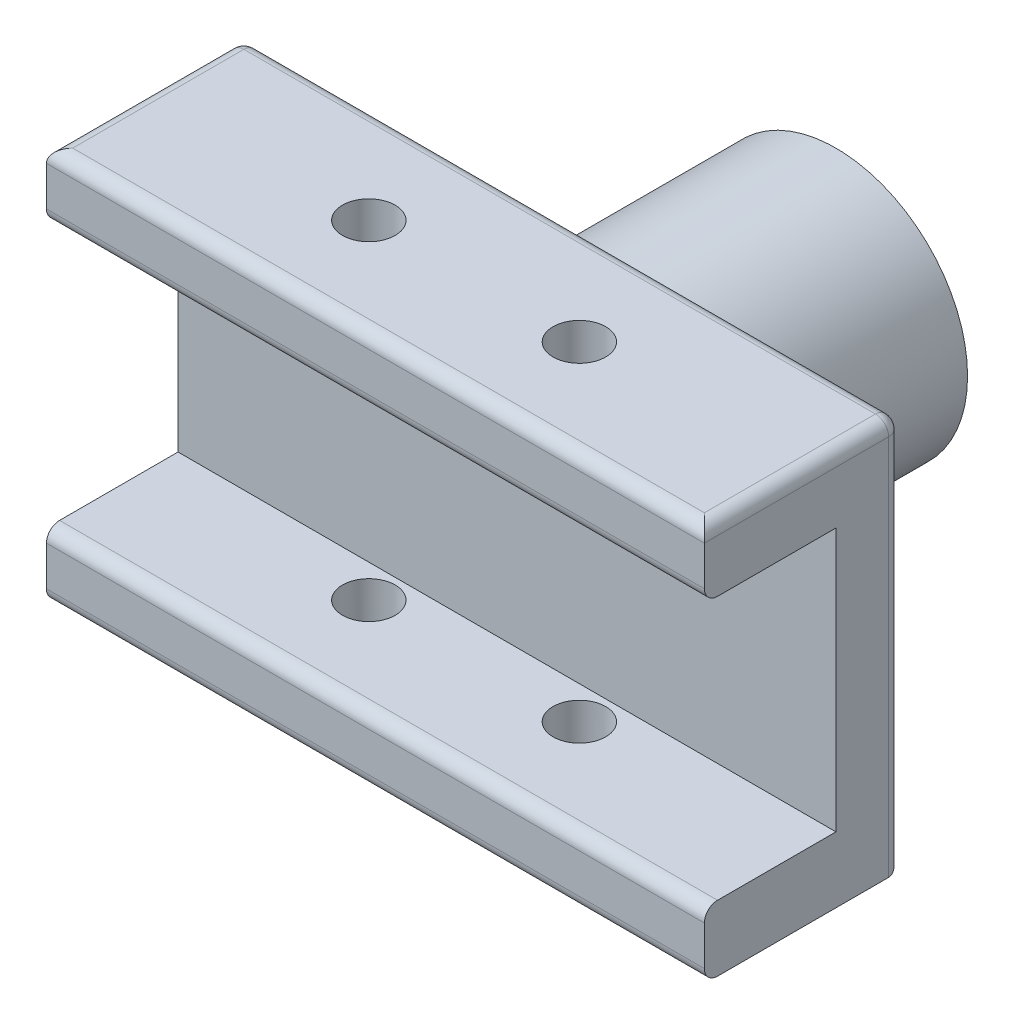
from build123d import *

# Parameters (mm, degrees)
SKETCH1_W           = 50
SKETCH1_H           = 30
BOSS_EXTRUDE1_DEPTH = 15
SKETCH2_W           = 50
SKETCH2_H           = 20
CUT_EXTRUDE1_DEPTH  = 10
SKETCH3_R           = 2
CUT_EXTRUDE2_DEPTH  = 42.833001327
SKETCH4_R           = 10
BOSS_EXTRUDE2_DEPTH = 20
FILLET3_R           = 1
FILLET4_R           = 1
FILLET5_R           = 1
FILLET6_R           = 1
FILLET7_R           = 1


with BuildPart() as part:
    # Sketch1 → Boss-Extrude1 (new body)
    with BuildSketch(Plane.XY):
        Rectangle(SKETCH1_W, SKETCH1_H)
    extrude(amount=BOSS_EXTRUDE1_DEPTH)

    # Sketch2 → Cut-Extrude1 (cut)
    with BuildSketch(Plane.XY.offset(15)):
        Rectangle(SKETCH2_W, SKETCH2_H)
    extrude(amount=-CUT_EXTRUDE1_DEPTH, mode=Mode.SUBTRACT)

    # Sketch3 → Cut-Extrude2 (cut, through all)
    with BuildSketch(Plane(origin=(0, 15, 0), x_dir=(1, 0, 0), z_dir=(0, 1, 0))):
        with Locations(Location((-8, -7.5, 0), (0, 0, 270))):
            Circle(SKETCH3_R)
        with Locations(Location((8, -7.5, 0), (0, 0, 270))):
            Circle(SKETCH3_R)
    extrude(amount=-CUT_EXTRUDE2_DEPTH, mode=Mode.SUBTRACT)

    # Sketch4 → Boss-Extrude2 (add)
    with BuildSketch(Plane(origin=(0, 0, 0), x_dir=(-1, 0, 0), z_dir=(0, 0, -1))):
        Circle(SKETCH4_R)
    extrude(amount=BOSS_EXTRUDE2_DEPTH)

    # Fillet3
    fillet3_edges = [part.edges().sort_by_distance(p)[0] for p in [
        (0, -10, 15),
    ]]
    fillet(fillet3_edges, radius=FILLET3_R)

    # Fillet4
    fillet4_edges = [part.edges().sort_by_distance(p)[0] for p in [
        (0, -15, 15),
    ]]
    fillet(fillet4_edges, radius=FILLET4_R)

    # Fillet5
    fillet5_edges = [part.edges().sort_by_distance(p)[0] for p in [
        (0, -15, 0),
        (-25, 0, 0),
        (0, 15, 0),
        (25, 0, 0),
        (-25, 15, 7.5),
        (25, 15, 7.5),
        (0, 15, 15),
    ]]
    fillet(fillet5_edges, radius=FILLET5_R)

    # Fillet6
    fillet6_edges = [part.edges().sort_by_distance(p)[0] for p in [
        (0, 10, 15),
    ]]
    fillet(fillet6_edges, radius=FILLET6_R)

    # Fillet7
    fillet7_edges = [part.edges().sort_by_distance(p)[0] for p in [
        (10, 0, 0),
    ]]
    fillet(fillet7_edges, radius=FILLET7_R)


solid = part.part
